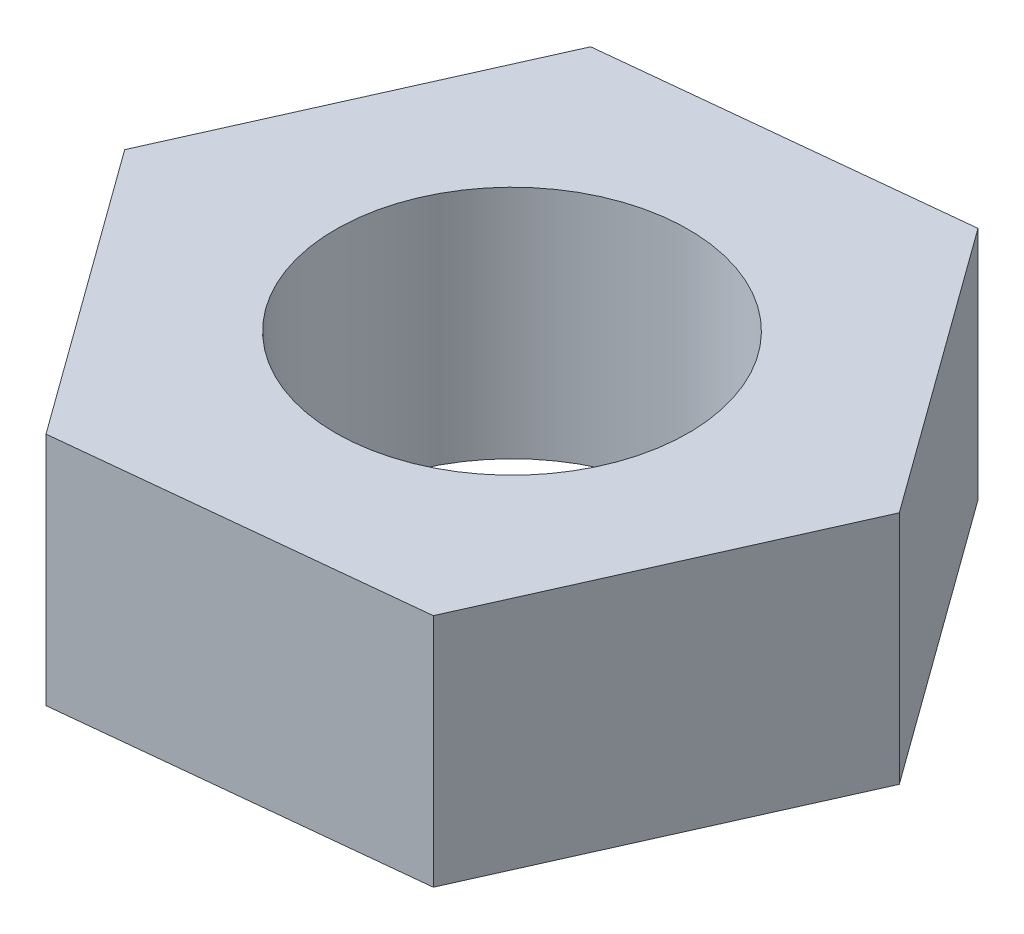
from build123d import *

# Parameters (mm, degrees)
SKETCH1_R           = 1.5
BOSS_EXTRUDE1_DEPTH = 2


with BuildPart() as part:
    # Sketch1 → Boss-Extrude1 (new body)
    with BuildSketch(Plane(origin=(0, 0, 0), x_dir=(1, 0, 0), z_dir=(0, 1, 0))):
        Polygon((-5.391564093, 4.149204269), (-8.375540398, 3.839550574), (-9.599360585, 1.100524442), (-7.839204466, -1.328847995), (-4.855228161, -1.0191943), (-3.631407975, 1.719831831), align=None)
        with Locations(Location((-6.61538428, 1.410178137, 0), (0, 0, 270))):
            Circle(SKETCH1_R, mode=Mode.SUBTRACT)
    extrude(amount=BOSS_EXTRUDE1_DEPTH)


solid = part.part
